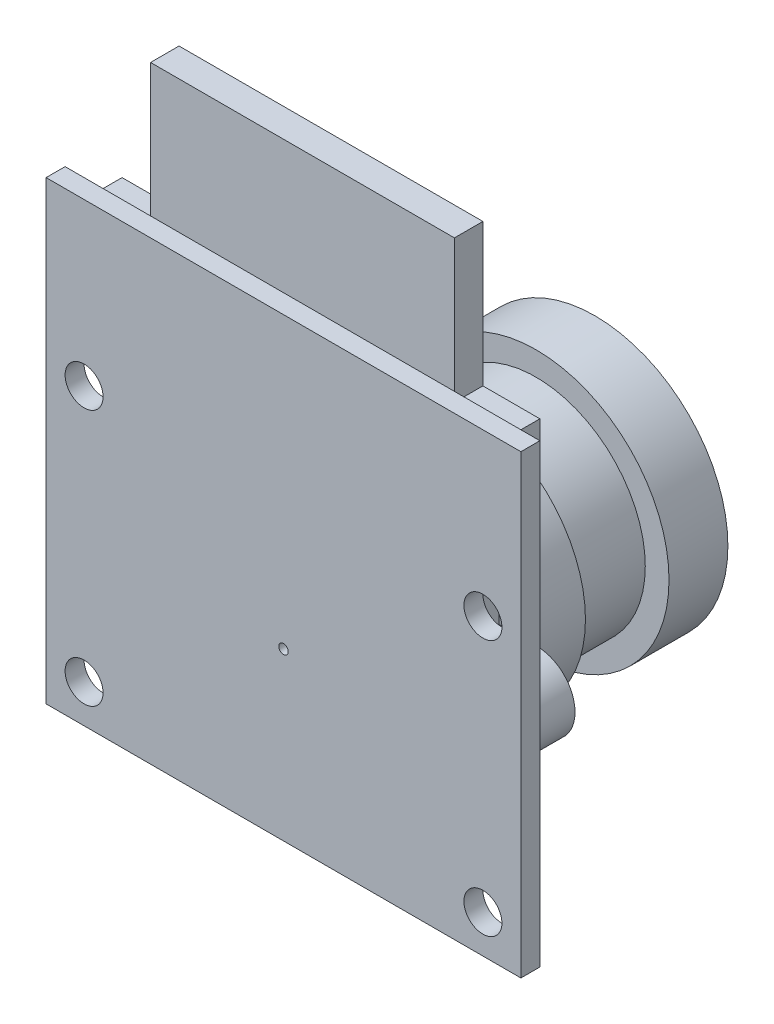
from build123d import *

# Parameters (mm, degrees)
SKETCH_1_W             = 25
SKETCH_1_H             = 24
EXTRUDE_354_DEPTH      = 1
EXTRUDE_536_DEPTH      = 3.8
SKETCH_3_W             = 22
SKETCH_3_H             = 4.802295703
EXTRUDE_803_DEPTH      = 1.5
HOLE_WIZARD_953_D      = 0.5
HOLE_WIZARD_953_DEPTH  = 1
HOLE_WIZARD_1615_D     = 2
HOLE_WIZARD_1615_DEPTH = 16.4
SKETCH_12_W            = 16
SKETCH_12_H            = 1.5
EXTRUDE_2779_DEPTH     = 7.5


with BuildPart() as part:
    # Эскиз1 → Extrude 354 (new body)
    with BuildSketch(Plane(origin=(0, 0, -1), x_dir=(-1, 0, 0), z_dir=(0, 0, -1))):
        with Locations((-12.5, 12)):
            Rectangle(SKETCH_1_W, SKETCH_1_H)
    extrude(amount=-EXTRUDE_354_DEPTH)

    # Эскиз2 → Extrude 536 (add)
    with BuildSketch(Plane(origin=(0, 0, -1), x_dir=(-1, 0, 0), z_dir=(0, 0, -1))):
        with BuildLine():
            Line((-5.95, 10.75), (-3.949995117, 10.75))
            ThreePointArc((-3.949995117, 10.75), (-1.949995117, 8.75), (-3.949995117, 6.75))
            Line((-3.949995117, 6.75), (-5.95, 6.75))
            Line((-5.95, 6.75), (-5.95, 2.2))
            Line((-5.95, 2.2), (-19.05, 2.2))
            Line((-19.05, 2.2), (-19.05, 6.75))
            Line((-19.05, 6.75), (-21.050009766, 6.75))
            ThreePointArc((-21.050009766, 6.75), (-23.050009766, 8.75), (-21.050009766, 10.75))
            Line((-21.050009766, 10.75), (-19.05, 10.75))
            Line((-19.05, 10.75), (-19.05, 15.3))
            Line((-19.05, 15.3), (-5.95, 15.3))
            Line((-5.95, 15.3), (-5.95, 10.75))
        make_face()
    extrude(amount=EXTRUDE_536_DEPTH)

    # Эскиз3 → Extrude 803 (add)
    with BuildSketch(Plane(origin=(0, 0, -1), x_dir=(-1, 0, 0), z_dir=(0, 0, -1))):
        with Locations((-12.5, 21.098852149)):
            Rectangle(SKETCH_3_W, SKETCH_3_H)
    extrude(amount=EXTRUDE_803_DEPTH)

    # Эскиз4 → Revolve 894 (revolve)
    with BuildSketch(Plane.XZ.offset(-8.75), mode=Mode.PRIVATE) as revolve_894_sk:
        Polygon((19.1, -4.8), (12.5, -4.8), (12.5, -16.4), (19.5, -16.4), (19.5, -13.3), (18.25, -13.3), (18.25, -9.3), (19.1, -9.3), align=None)
    revolve(revolve_894_sk.sketch.rotate(Axis((12.5, 8.75, -4.8), (0, 0, -1)), 180), axis=Axis((12.5, 8.75, -4.8), (0, 0, -1)))

    # Hole Wizard 953
    with Locations(Plane.XY):
        with Locations((12.5, 8.75)):
            Hole(HOLE_WIZARD_953_D / 2, depth=HOLE_WIZARD_953_DEPTH)

    # Hole Wizard 1615
    with Locations(Plane.XY):
        with Locations((2, 2), (2, 15.5), (23, 15.5), (23, 2)):
            Hole(HOLE_WIZARD_1615_D / 2, depth=HOLE_WIZARD_1615_DEPTH)

    # Эскиз12 → Extrude 2779 (add)
    with BuildSketch(Plane(origin=(0, 23.5, 0), x_dir=(1, 0, 0), z_dir=(0, 1, 0))):
        with Locations((12.5, 1.75)):
            Rectangle(SKETCH_12_W, SKETCH_12_H)
    extrude(amount=EXTRUDE_2779_DEPTH)


solid = part.part
